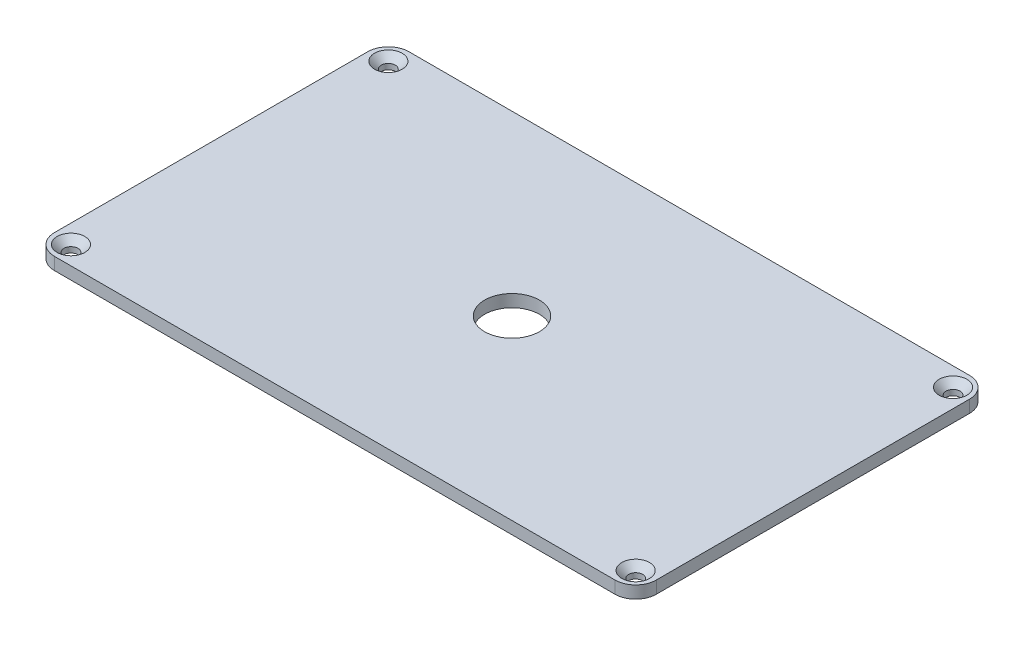
from build123d import *

# Parameters (mm, degrees)
SKETCH1_W                    = 146
SKETCH1_H                    = 86
BOSS_EXTRUDE1_DEPTH          = 3
CSK_FOR_M3_SFHCS1_AT_2_COUNT = 2
CSK_FOR_M3_SFHCS1_AT_2_PITCH = 77
CSK_FOR_M3_SFHCS1_AT_3_COUNT = 2
CSK_FOR_M3_SFHCS1_AT_3_PITCH = 157.155973479
CSK_FOR_M3_SFHCS1_AT_4_COUNT = 2
CSK_FOR_M3_SFHCS1_AT_4_PITCH = 137
SKETCH5_R                    = 6.65
CUT_EXTRUDE1_DEPTH           = 14
SKETCH6_W                    = 6.85
SKETCH6_H                    = 19.5
SKETCH6_R                    = 1.5
BOSS_EXTRUDE2_DEPTH          = 10
SKETCH7_W                    = 7.05
SKETCH7_H                    = 2.001587211
SKETCH7_H_2                  = 2.00158721
CUT_EXTRUDE2_DEPTH           = 3
FILLET1_R                    = 5


with BuildPart() as part:
    # Sketch1 → Boss-Extrude1 (new body)
    with BuildSketch(Plane(origin=(0, 0, 0), x_dir=(1, 0, 0), z_dir=(0, 1, 0))):
        with Locations((6.693779904, -0.746411483)):
            Rectangle(SKETCH1_W, SKETCH1_H)
    extrude(amount=BOSS_EXTRUDE1_DEPTH)

    # Sketch3 → CSK for M3 SFHCS1 (revolve, cut)
    with BuildSketch(Plane(origin=(-61.806220096, 3, 39.246411483), x_dir=(0, 0, 1), z_dir=(1, 0, 0))):
        Polygon((0, 0), (0, 3), (1.7, 3), (1.7, 1.66), (3.36, 0), align=None)
    csk_for_m3_sfhcs1 = revolve(axis=Axis((-61.806220096, 9.35, 39.246411483), (0, -1, 0)), mode=Mode.SUBTRACT)

    # CSK for M3 SFHCS1 at 2: CSK for M3 SFHCS1 ×2
    with Locations(*[(0, 0, -i * CSK_FOR_M3_SFHCS1_AT_2_PITCH) for i in range(1, CSK_FOR_M3_SFHCS1_AT_2_COUNT)]):
        add(csk_for_m3_sfhcs1, mode=Mode.SUBTRACT)

    # CSK for M3 SFHCS1 at 3: CSK for M3 SFHCS1 ×2
    with Locations(*[Vector(0.8717454193280995, 0, -0.48995910429389533) * (i * CSK_FOR_M3_SFHCS1_AT_3_PITCH) for i in range(1, CSK_FOR_M3_SFHCS1_AT_3_COUNT)]):
        add(csk_for_m3_sfhcs1, mode=Mode.SUBTRACT)

    # CSK for M3 SFHCS1 at 4: CSK for M3 SFHCS1 ×2
    with Locations(*[(i * CSK_FOR_M3_SFHCS1_AT_4_PITCH, 0, 0) for i in range(1, CSK_FOR_M3_SFHCS1_AT_4_COUNT)]):
        add(csk_for_m3_sfhcs1, mode=Mode.SUBTRACT)

    # Sketch5 → Cut-Extrude1 (cut)
    with BuildSketch(Plane.XZ):
        with Locations(Location((6.693779904, 0.746411483, 0), (0, 0, 270))):
            Circle(SKETCH5_R)
    extrude(amount=-CUT_EXTRUDE1_DEPTH, mode=Mode.SUBTRACT)

    # Sketch6 → Boss-Extrude2 (add)
    # profile 1 of 2: a face of its own
    with BuildSketch(Plane.XZ):
        with Locations((-26.631220096, 0.746411483)):
            Rectangle(SKETCH6_W, SKETCH6_H)
        with Locations(Location((-27.471220096, 5.746411483, 0), (0, 0, 270))):
            Circle(SKETCH6_R, mode=Mode.SUBTRACT)
        with Locations(Location((-27.471220096, -4.253588517, 0), (0, 0, 270))):
            Circle(SKETCH6_R, mode=Mode.SUBTRACT)
    # profile 2 of 2: a face of its own
    with BuildSketch(Plane.XZ):
        with Locations((20.518779904, 0.746411483)):
            Rectangle(SKETCH6_W, SKETCH6_H)
        with Locations(Location((21.358779904, 5.746411483, 0), (0, 0, 270))):
            Circle(SKETCH6_R, mode=Mode.SUBTRACT)
        with Locations(Location((21.358779904, -4.253588517, 0), (0, 0, 270))):
            Circle(SKETCH6_R, mode=Mode.SUBTRACT)
    extrude(amount=BOSS_EXTRUDE2_DEPTH)

    # Sketch7 → Cut-Extrude2 (cut)
    with BuildSketch(Plane.XZ.offset(10)):
        with Locations((-26.731220096, 0.742822967)):
            Rectangle(SKETCH7_W, SKETCH7_H)
        with Locations((20.418779904, 0.746411483)):
            Rectangle(SKETCH7_W, SKETCH7_H_2)
    extrude(amount=-CUT_EXTRUDE2_DEPTH, mode=Mode.SUBTRACT)

    # Fillet1
    fillet1_edges = [part.edges().sort_by_distance(p)[0] for p in [
        (-66.306220096, 1.5, -42.253588517),
        (79.693779904, 1.5, -42.253588517),
        (79.693779904, 1.5, 43.746411483),
        (-66.306220096, 1.5, 43.746411483),
    ]]
    fillet(fillet1_edges, radius=FILLET1_R)


solid = part.part
